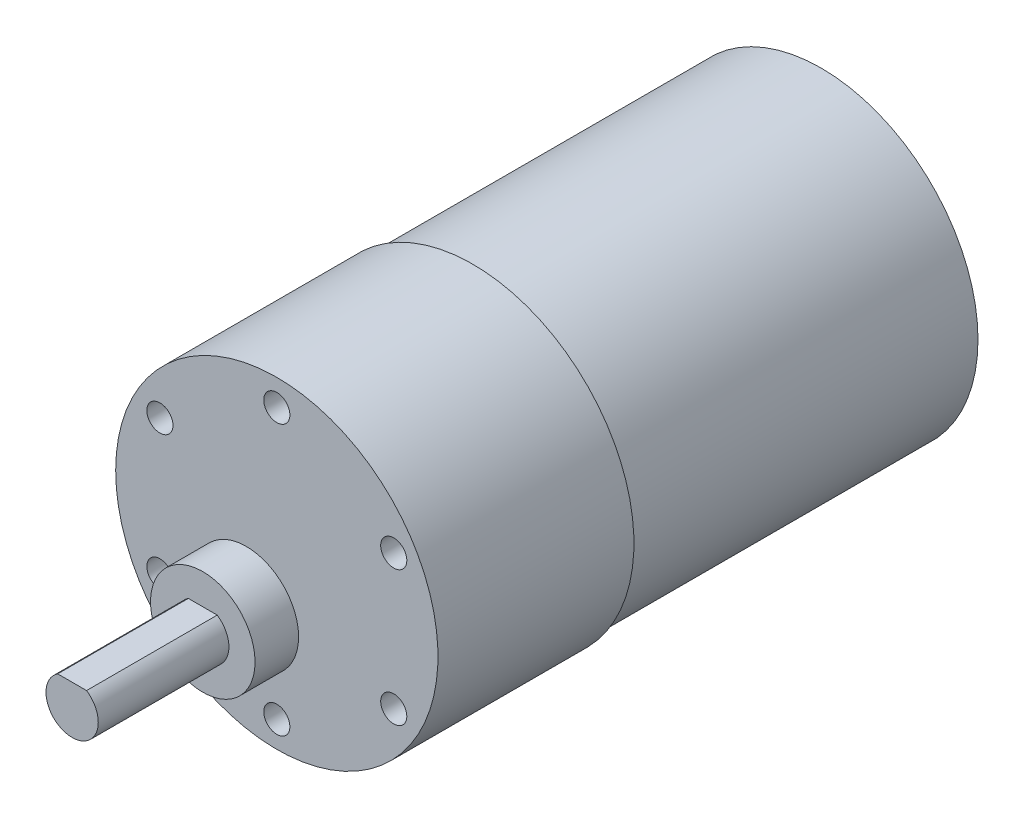
from build123d import *

# Parameters (mm, degrees)
SKETCH_1_R               = 18
EXTRUDE_1_DEPTH          = 40
SKETCH_2_R               = 18.5
EXTRUDE_2_DEPTH          = 22.5
SKETCH_3_R               = 6
EXTRUDE_3_DEPTH          = 5
EXTRUDE_4_DEPTH          = 20
SKETCH_5_R               = 1.5
CUT_EXTRUDE_1_DEPTH      = 5
PATTERN_CIRCULAR_1_COUNT = 6


with BuildPart() as part:
    # 草图1 → 凸台-拉伸1 (new body)
    with BuildSketch(Plane.XY):
        Circle(SKETCH_1_R)
    extrude(amount=-EXTRUDE_1_DEPTH)

    # 草图2 → 凸台-拉伸2 (add)
    with BuildSketch(Plane.XY):
        with Locations(Location((0, 0, 0), (0, 0, 180))):
            Circle(SKETCH_2_R)
    extrude(amount=EXTRUDE_2_DEPTH)

    # 草图3 → 凸台-拉伸3 (add)
    with BuildSketch(Plane.XY.offset(22.5)):
        with Locations((-3.5, -6.062177826)):
            Circle(SKETCH_3_R)
    extrude(amount=EXTRUDE_3_DEPTH)

    # 草图4 → 凸台-拉伸4 (add)
    with BuildSketch(Plane.XY.offset(22.5)):
        with BuildLine():
            Line((-1.841687605, -3.562177826), (-5.158312395, -3.562177826))
            ThreePointArc((-5.158312395, -3.562177826), (-3.5, -9.062177826), (-1.841687605, -3.562177826))
        make_face()
    extrude(amount=EXTRUDE_4_DEPTH)

    # 草图5 → 切除-拉伸1 (cut)
    with BuildSketch(Plane.XY.offset(22.5)):
        with Locations((0, 15.5)):
            Circle(SKETCH_5_R)
    cut_extrude_1 = extrude(amount=-CUT_EXTRUDE_1_DEPTH, mode=Mode.SUBTRACT)

    # 阵列(圆周)1: 切除-拉伸1 ×6 about axis
    pattern_circular_1_axis = Axis((0, 0, 0), (0, 0, 1))
    for i in range(1, PATTERN_CIRCULAR_1_COUNT):
        add(cut_extrude_1.rotate(pattern_circular_1_axis, i * 360 / PATTERN_CIRCULAR_1_COUNT), mode=Mode.SUBTRACT)


solid = part.part
